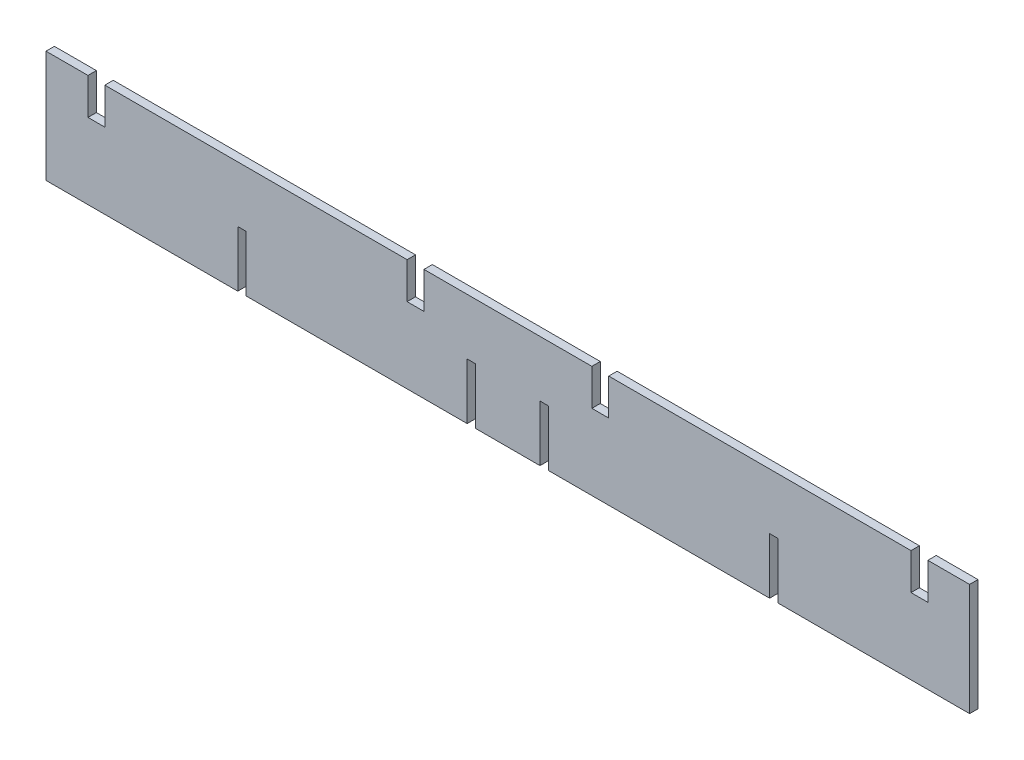
from build123d import *

# Parameters (mm, degrees)
SKETCH1_W           = 660
SKETCH1_H           = 80
BOSS_EXTRUDE1_DEPTH = 6
SKETCH2_W           = 12.04
SKETCH2_H           = 26
CUT_EXTRUDE1_DEPTH  = 333.469547478
SKETCH3_W           = 6.04
SKETCH3_H           = 40
CUT_EXTRUDE2_DEPTH  = 333.469547478
SKETCH4_W           = 6.04
SKETCH4_H           = 40
CUT_EXTRUDE3_DEPTH  = 333.469547478


with BuildPart() as part:
    # Sketch1 → Boss-Extrude1 (new body)
    with BuildSketch(Plane.XY):
        Rectangle(SKETCH1_W, SKETCH1_H)
    extrude(amount=BOSS_EXTRUDE1_DEPTH)

    # Sketch2 → Cut-Extrude1 (cut, through all)
    with BuildSketch(Plane.XY.offset(6)):
        with Locations((-293.98, 27)):
            Rectangle(SKETCH2_W, SKETCH2_H)
        with Locations((-65.94, 27)):
            Rectangle(SKETCH2_W, SKETCH2_H)
        with Locations((66.1, 27)):
            Rectangle(SKETCH2_W, SKETCH2_H)
        with Locations((294.14, 27)):
            Rectangle(SKETCH2_W, SKETCH2_H)
    extrude(amount=-CUT_EXTRUDE1_DEPTH, mode=Mode.SUBTRACT)

    # Sketch3 → Cut-Extrude2 (cut, through all)
    with BuildSketch(Plane.XY.offset(6)):
        with Locations((-26.02, -20)):
            Rectangle(SKETCH3_W, SKETCH3_H)
        with Locations((26.02, -20)):
            Rectangle(SKETCH3_W, SKETCH3_H)
    extrude(amount=-CUT_EXTRUDE2_DEPTH, mode=Mode.SUBTRACT)

    # Sketch4 → Cut-Extrude3 (cut, through all)
    with BuildSketch(Plane.XY.offset(6)):
        with Locations((-189.94, -20)):
            Rectangle(SKETCH4_W, SKETCH4_H)
        with Locations((190.1, -20)):
            Rectangle(SKETCH4_W, SKETCH4_H)
    extrude(amount=-CUT_EXTRUDE3_DEPTH, mode=Mode.SUBTRACT)


solid = part.part
